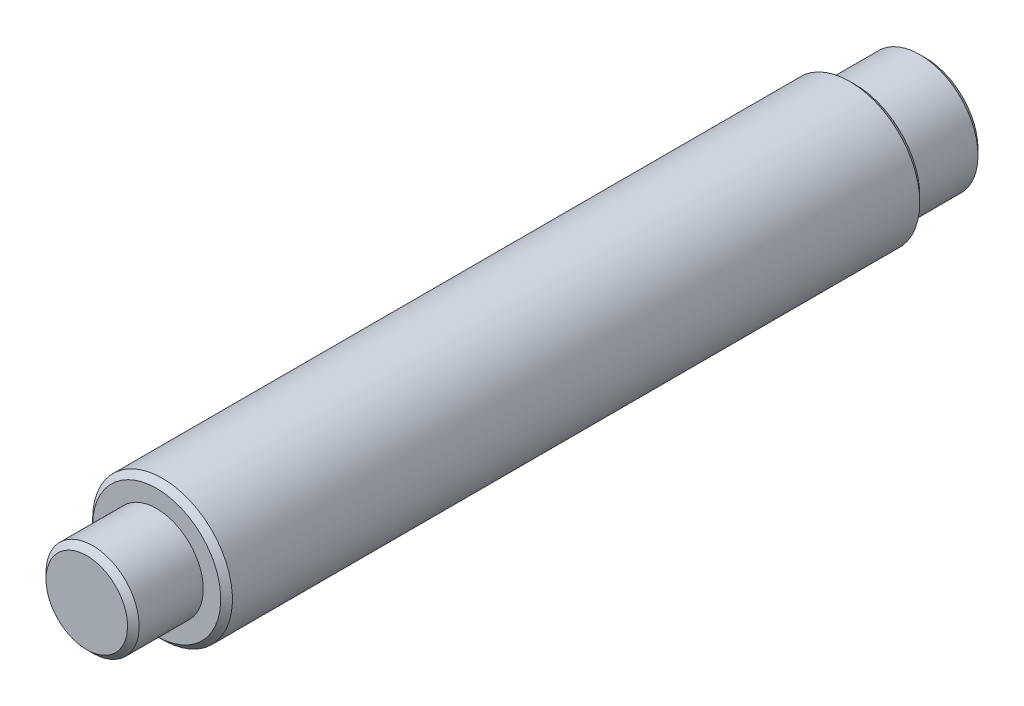
from build123d import *

# Parameters (mm, degrees)
ESQUISSE1_R             = 5
BASE_EXTRUSION_DEPTH    = 6
ESQUISSE2_R             = 6
BOSS_EXTRU_1_DEPTH      = 60
ESQUISSE3_R             = 4
BOSS_EXTRU_2_DEPTH      = 6
CHANFREIN1_SIZE         = 0.5
ESQUISSE4_R             = 2.5
ENL_V_MAT_EXTRU_1_DEPTH = 7


with BuildPart() as part:
    # Esquisse1 → Base-Extrusion (new body)
    with BuildSketch(Plane.XY):
        with Locations(Location((0, 0, 0), (0, 0, 180))):
            Circle(ESQUISSE1_R)
    extrude(amount=BASE_EXTRUSION_DEPTH)

    # Esquisse2 → Boss.-Extru.1 (add)
    with BuildSketch(Plane.XY.offset(6)):
        with Locations(Location((0, 0, 0), (0, 0, 180))):
            Circle(ESQUISSE2_R)
    extrude(amount=BOSS_EXTRU_1_DEPTH)

    # Esquisse3 → Boss.-Extru.2 (add)
    with BuildSketch(Plane.XY.offset(66)):
        with Locations(Location((0, 0, 0), (0, 0, 180))):
            Circle(ESQUISSE3_R)
    extrude(amount=BOSS_EXTRU_2_DEPTH)

    # Chanfrein1
    chanfrein1_edges = [part.edges().sort_by_distance(p)[0] for p in [
        (6, 0, 6),
        (6, 0, 66),
        (5, 0, 0),
        (4, 0, 72),
    ]]
    chamfer(chanfrein1_edges, length=CHANFREIN1_SIZE)

    # Esquisse4 → Enlèv. mat.-Extru.1 (cut)
    with BuildSketch(Plane(origin=(0, 0, 0), x_dir=(1, 0, 0), z_dir=(0, 1, 0))):
        with Locations(Location((0, -44, 0), (0, 0, 270))):
            Circle(ESQUISSE4_R)
    extrude(amount=-ENL_V_MAT_EXTRU_1_DEPTH, mode=Mode.SUBTRACT)


solid = part.part
